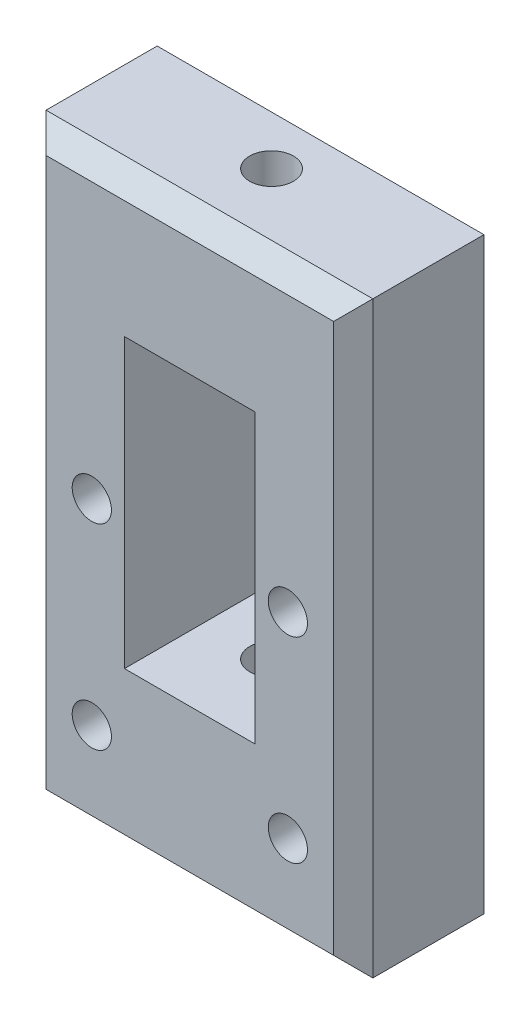
from build123d import *

# Parameters (mm, degrees)
SKETCH1_W           = 50
SKETCH1_H           = 90
SKETCH1_R           = 3
BOSS_EXTRUDE1_DEPTH = 20
SKETCH2_R           = 3.35
CUT_EXTRUDE1_DEPTH  = 156.32224567
CUT_EXTRUDE2_DEPTH  = 159.271917913
CHAMFER1_SIZE       = 3


with BuildPart() as part:
    # Sketch1 → Boss-Extrude1 (new body)
    with BuildSketch(Plane.XY):
        with Locations((100, 50)):
            Rectangle(SKETCH1_W, SKETCH1_H)
        with Locations((115, 20)):
            Circle(SKETCH1_R, mode=Mode.SUBTRACT)
        with Locations((85, 20)):
            Circle(SKETCH1_R, mode=Mode.SUBTRACT)
        with Locations((85, 50)):
            Circle(SKETCH1_R, mode=Mode.SUBTRACT)
        with Locations((115, 50)):
            Circle(SKETCH1_R, mode=Mode.SUBTRACT)
    extrude(amount=BOSS_EXTRUDE1_DEPTH)

    # Sketch2 → Cut-Extrude1 (cut, through all)
    with BuildSketch(Plane(origin=(0, 95, 0), x_dir=(1, 0, 0), z_dir=(0, 1, 0))):
        with Locations(Location((100, -7.5, 0), (0, 0, 270))):
            Circle(SKETCH2_R)
    extrude(amount=-CUT_EXTRUDE1_DEPTH, mode=Mode.SUBTRACT)

    # Sketch3 → Cut-Extrude2 (cut, through all)
    with BuildSketch(Plane.XY.offset(20)):
        Polygon((90, 70), (90, 74), (110, 74), (110, 70), (110, 30), (90, 30), align=None)
    extrude(amount=-CUT_EXTRUDE2_DEPTH, mode=Mode.SUBTRACT)

    # Chamfer1
    chamfer1_edges = [part.edges().sort_by_distance(p)[0] for p in [
        (75, 50, 20),
        (100, 5, 20),
        (125, 50, 20),
        (100, 95, 20),
    ]]
    chamfer(chamfer1_edges, length=CHAMFER1_SIZE)


solid = part.part
